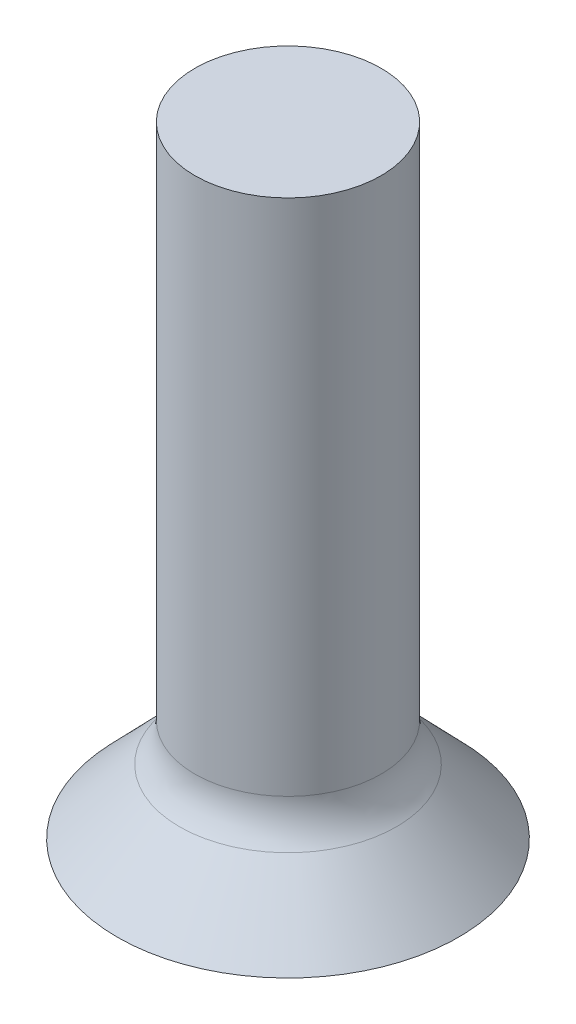
from build123d import *

# Parameters (mm, degrees)
CUT_EXTRUDE_1_DEPTH = 0.495


with BuildPart() as part:
    # 草图1 → 旋转1 (revolve)
    with BuildSketch(Plane.XY, mode=Mode.PRIVATE) as revolve_1_sk:
        with BuildLine():
            Line((0, 0), (2.75, 0))
            Line((2.75, 0), (1.747011561, 1.038624933))
            ThreePointArc((1.747011561, 1.038624933), (1.564086143, 1.320305375), (1.5, 1.65))
            Line((1.5, 1.65), (1.5, 10))
            Line((1.5, 10), (0, 10))
            Line((0, 10), (0, 0))
        make_face()
    revolve(revolve_1_sk.sketch.rotate(Axis((0, 3.09547163, 0), (0, -1, 0)), 90), axis=Axis((0, 3.09547163, 0), (0, -1, 0)))

    # 草图2 → 切除-拉伸1 (cut)
    with BuildSketch(Plane.XZ):
        Polygon((-0.375, -0.375), (-0.375, -1.925), (0.375, -1.925), (0.375, -0.375), (1.925, -0.375), (1.925, 0.375), (0.375, 0.375), (0.375, 1.925), (-0.375, 1.925), (-0.375, 0.375), (-1.925, 0.375), (-1.925, -0.375), align=None)
    extrude(amount=-CUT_EXTRUDE_1_DEPTH, mode=Mode.SUBTRACT)


solid = part.part
